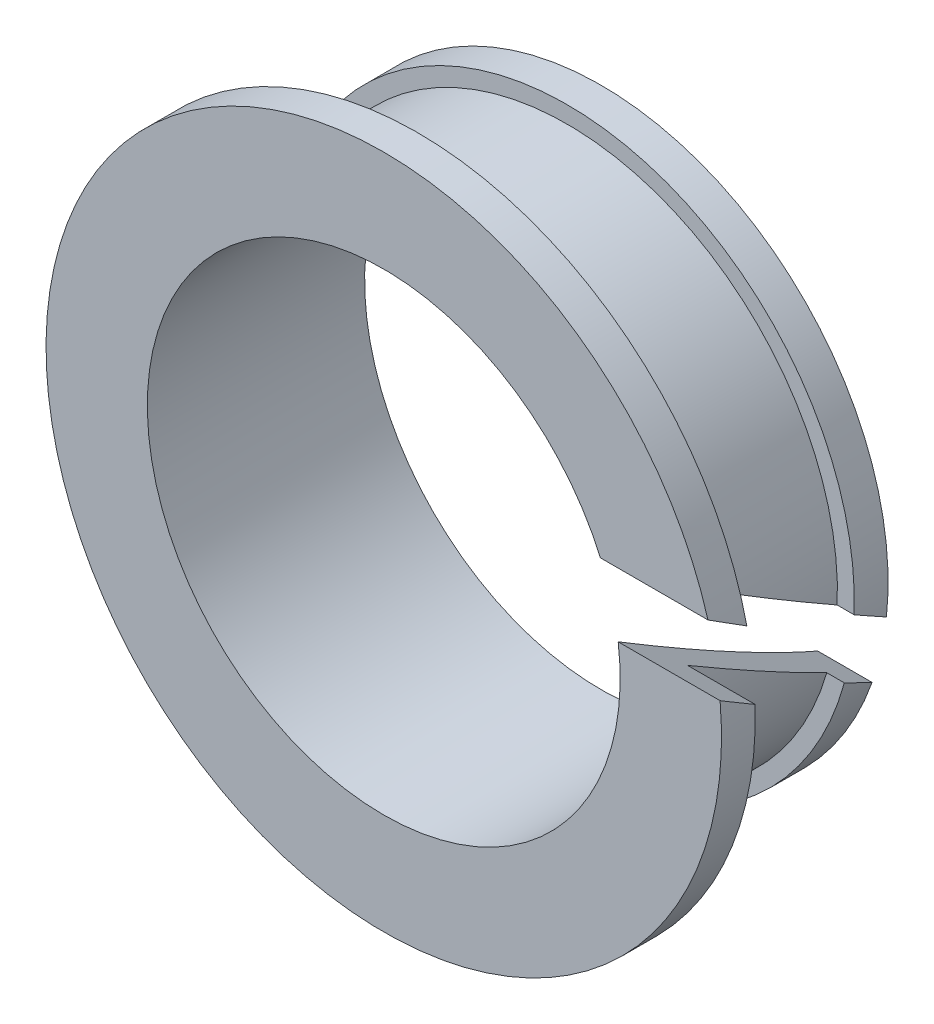
from build123d import *

# Parameters (mm, degrees)
CUT_EXTRUDE1_DEPTH = 12.511910779


with BuildPart() as part:
    # Sketch1 → Revolve1 (revolve)
    with BuildSketch(Plane(origin=(0, 0, 0), x_dir=(0, 0, -1), z_dir=(1, 0, 0)), mode=Mode.PRIVATE) as revolve1_sk:
        Polygon((-2.5527, 5.55625), (2.5527, 5.55625), (2.5527, 6.746875), (1.75895, 6.746875), (1.75895, 6.35), (-1.75895, 6.35), (-1.75895, 7.9375), (-2.5527, 7.9375), align=None)
    revolve(revolve1_sk.sketch.rotate(Axis((0, 0, 22.513636364), (0, 0, -1)), 90), axis=Axis((0, 0, 22.513636364), (0, 0, -1)))

    # Sketch2 → Cut-Extrude1 (cut, through all)
    with BuildSketch(Plane(origin=(0, 0, 0), x_dir=(0, 0, -1), z_dir=(1, 0, 0))):
        Polygon((-2.5527, 0.723802032), (-2.5527, 2.223802032), (2.5527, -0.723802032), (2.5527, -2.223802032), align=None)
    extrude(amount=CUT_EXTRUDE1_DEPTH, mode=Mode.SUBTRACT)


solid = part.part
